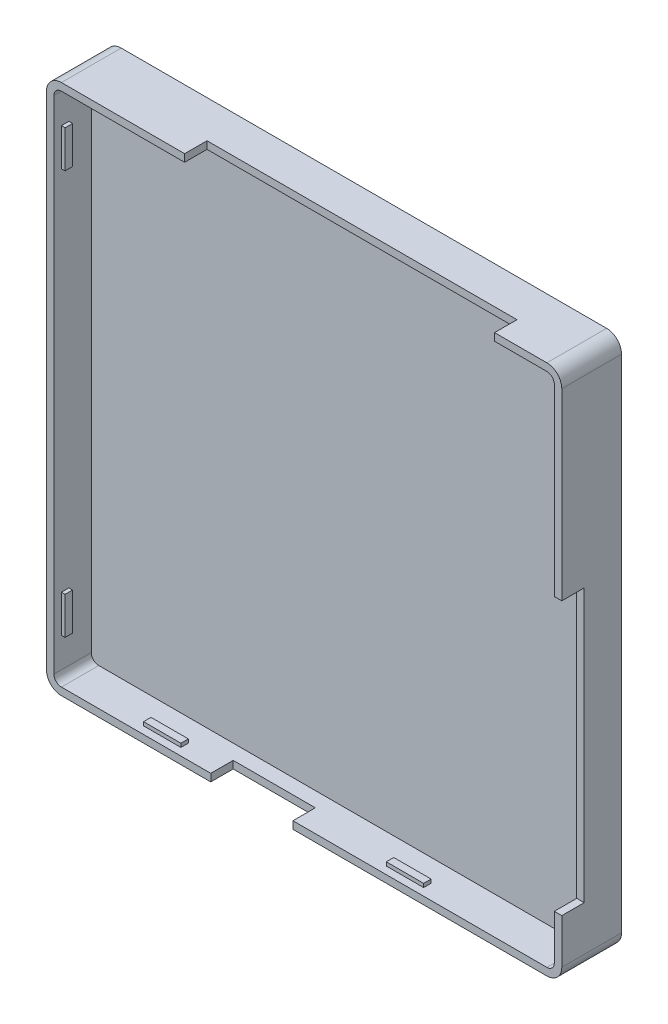
from build123d import *

# Parameters (mm, degrees)
BOSS_EXTRU_1_DEPTH      = 8
ENL_V_MAT_EXTRU_1_DEPTH = 5
ESQUISSE4_W             = 5
ESQUISSE4_H             = 1
BOSS_EXTRU_3_DEPTH      = 0.48904
ESQUISSE5_W             = 1
ESQUISSE5_H             = 5
BOSS_EXTRU_4_DEPTH      = 0.48904
ESQUISSE6_W             = 1
ESQUISSE6_H             = 5
BOSS_EXTRU_5_DEPTH      = 0.48904
ESQUISSE7_W             = 1
ESQUISSE7_H             = 5
BOSS_EXTRU_6_DEPTH      = 0.48904
ESQUISSE8_W             = 5
ESQUISSE8_H             = 1
BOSS_EXTRU_7_DEPTH      = 0.48904
ESQUISSE9_W             = 5
ESQUISSE9_H             = 1
BOSS_EXTRU_8_DEPTH      = 0.48904
ESQUISSE10_W            = 3
ESQUISSE10_H            = 36.5
ENL_V_MAT_EXTRU_3_DEPTH = 99.707699801
ESQUISSE11_W            = 41.5
ESQUISSE11_H            = 3
ENL_V_MAT_EXTRU_4_DEPTH = 99.686422572
ESQUISSE12_W            = 11
ESQUISSE12_H            = 3
ENL_V_MAT_EXTRU_5_DEPTH = 99.686422572


with BuildPart() as part:
    # Esquisse1 → Boss.-Extru.1 (new body)
    with BuildSketch(Plane.XY):
        with BuildLine():
            Line((2, 0), (67, 0))
            ThreePointArc((67, 0), (68.414213562, 0.585786438), (69, 2))
            Line((69, 2), (69, 69.1))
            ThreePointArc((69, 69.1), (68.414213562, 70.514213562), (67, 71.1))
            Line((67, 71.1), (2, 71.1))
            ThreePointArc((2, 71.1), (0.585786438, 70.514213562), (0, 69.1))
            Line((0, 69.1), (0, 2))
            ThreePointArc((0, 2), (0.585786438, 0.585786438), (2, 0))
        make_face()
    extrude(amount=BOSS_EXTRU_1_DEPTH)

    # Esquisse3 → Enlèv. mat.-Extru.1 (cut)
    with BuildSketch(Plane.XY.offset(8)):
        with BuildLine():
            Line((2, 1), (67, 1))
            ThreePointArc((67, 1), (67.707106781, 1.292893219), (68, 2))
            Line((68, 2), (68, 69.1))
            ThreePointArc((68, 69.1), (67.707106781, 69.807106781), (67, 70.1))
            Line((67, 70.1), (2, 70.1))
            ThreePointArc((2, 70.1), (1.292893219, 69.807106781), (1, 69.1))
            Line((1, 69.1), (1, 2))
            ThreePointArc((1, 2), (1.292893219, 1.292893219), (2, 1))
        make_face()
    extrude(amount=-ENL_V_MAT_EXTRU_1_DEPTH, mode=Mode.SUBTRACT)

    # Esquisse4 → Boss.-Extru.3 (add)
    with BuildSketch(Plane.XZ.offset(-70.1)):
        with Locations((10.679731729, 6.5)):
            Rectangle(ESQUISSE4_W, ESQUISSE4_H)
    extrude(amount=BOSS_EXTRU_3_DEPTH)

    # Esquisse5 → Boss.-Extru.4 (add)
    with BuildSketch(Plane.ZY.offset(-68)):
        with Locations((6.5, 63.6)):
            Rectangle(ESQUISSE5_W, ESQUISSE5_H)
    extrude(amount=BOSS_EXTRU_4_DEPTH)

    # Esquisse6 → Boss.-Extru.5 (add)
    with BuildSketch(Plane(origin=(1, 0, 0), x_dir=(0, 0, -1), z_dir=(1, 0, 0))):
        with Locations((-6.5, 62.6)):
            Rectangle(ESQUISSE6_W, ESQUISSE6_H)
    extrude(amount=BOSS_EXTRU_5_DEPTH)

    # Esquisse7 → Boss.-Extru.6 (add)
    with BuildSketch(Plane(origin=(1, 0, 0), x_dir=(0, 0, -1), z_dir=(1, 0, 0))):
        with Locations((-6.5, 8.5)):
            Rectangle(ESQUISSE7_W, ESQUISSE7_H)
    extrude(amount=BOSS_EXTRU_6_DEPTH)

    # Esquisse8 → Boss.-Extru.7 (add)
    with BuildSketch(Plane(origin=(0, 1, 0), x_dir=(1, 0, 0), z_dir=(0, 1, 0))):
        with Locations((14.5, -6.5)):
            Rectangle(ESQUISSE8_W, ESQUISSE8_H)
    extrude(amount=BOSS_EXTRU_7_DEPTH)

    # Esquisse9 → Boss.-Extru.8 (add)
    with BuildSketch(Plane(origin=(0, 1, 0), x_dir=(1, 0, 0), z_dir=(0, 1, 0))):
        with Locations((47, -6.5)):
            Rectangle(ESQUISSE9_W, ESQUISSE9_H)
    extrude(amount=BOSS_EXTRU_8_DEPTH)

    # Esquisse10 → Enlèv. mat.-Extru.3 (cut, through all)
    with BuildSketch(Plane.ZY.offset(-68)):
        with Locations((6.5, 26.25)):
            Rectangle(ESQUISSE10_W, ESQUISSE10_H)
    extrude(amount=-ENL_V_MAT_EXTRU_3_DEPTH, mode=Mode.SUBTRACT)

    # Esquisse11 → Enlèv. mat.-Extru.4 (cut, through all)
    with BuildSketch(Plane.XZ.offset(-70.1)):
        with Locations((39.25, 6.5)):
            Rectangle(ESQUISSE11_W, ESQUISSE11_H)
    extrude(amount=-ENL_V_MAT_EXTRU_4_DEPTH, mode=Mode.SUBTRACT)

    # Esquisse12 → Enlèv. mat.-Extru.5 (cut, through all)
    with BuildSketch(Plane(origin=(0, 1, 0), x_dir=(1, 0, 0), z_dir=(0, 1, 0))):
        with Locations((27.5, -6.5)):
            Rectangle(ESQUISSE12_W, ESQUISSE12_H)
    extrude(amount=-ENL_V_MAT_EXTRU_5_DEPTH, mode=Mode.SUBTRACT)


solid = part.part
